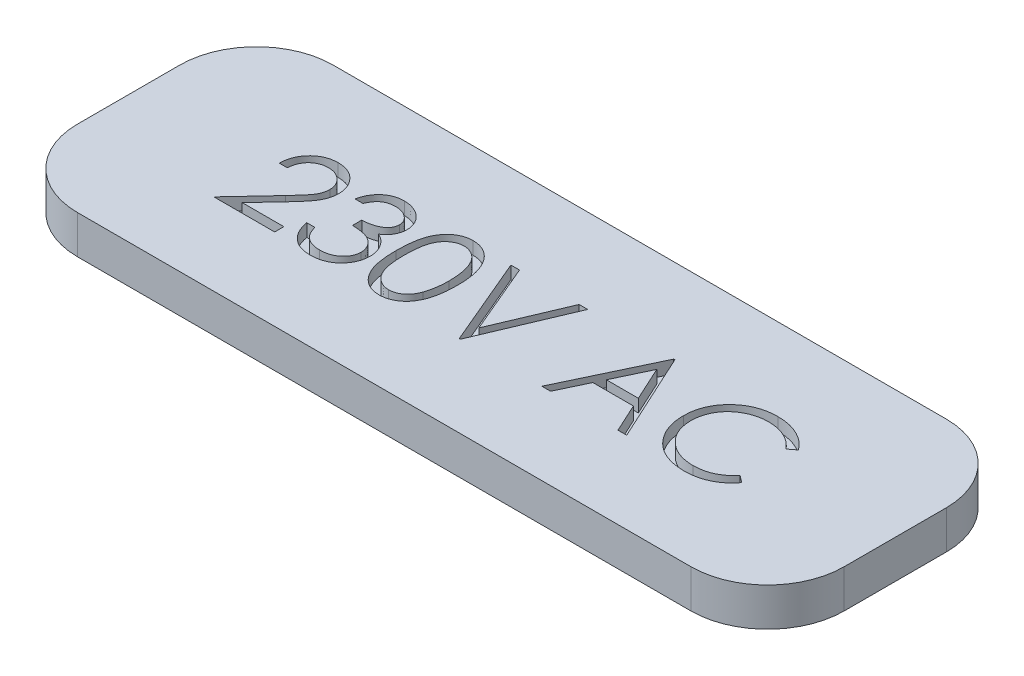
from build123d import *

# Parameters (mm, degrees)
SKETCH1_W           = 30
SKETCH1_H           = 10
BOSS_EXTRUDE1_DEPTH = 1.5
FILLET1_R           = 3
CUT_EXTRUDE1_DEPTH  = 0.5


with BuildPart() as part:
    # Sketch1 → Boss-Extrude1 (new body)
    with BuildSketch(Plane(origin=(0, 0, 0), x_dir=(1, 0, 0), z_dir=(0, 1, 0))):
        with Locations((-15, -5)):
            Rectangle(SKETCH1_W, SKETCH1_H)
    extrude(amount=BOSS_EXTRUDE1_DEPTH)

    # Fillet1
    fillet1_edges = [part.edges().sort_by_distance(p)[0] for p in [
        (0, 0.75, 10),
        (-30, 0.75, 10),
        (-30, 0.75, 0),
        (0, 0.75, 0),
    ]]
    fillet(fillet1_edges, radius=FILLET1_R)

    # Sketch2 → Cut-Extrude1 (cut)
    # profile 1 of 6: a face of its own
    with BuildSketch(Plane(origin=(0, 1.5, 0), x_dir=(1, 0, 0), z_dir=(0, 1, 0))):
        with BuildLine():
            Line((-24.416666667, -4.376923077), (-24.730769231, -4.376923077))
            add(Edge.make_bspline(
                [(-24.730769231, -4.376923077), (-24.728722078, -4.335252189), (-24.724701524, -4.253411675), (-24.705873234, -4.134087768), (-24.678932357, -4.020032969), (-24.640840903, -3.912163055), (-24.593534625, -3.809524248), (-24.536804598, -3.712524233), (-24.469610748, -3.621533044), (-24.393404014, -3.537394201), (-24.310635374, -3.46020663), (-24.221329435, -3.393551387), (-24.127484408, -3.337233716), (-24.029385009, -3.290152474), (-23.925924445, -3.254812628), (-23.818041587, -3.228590988), (-23.705262451, -3.212814643), (-23.628422429, -3.211118857), (-23.589342949, -3.21025641)],
                knots=[0, 0, 0, 0, 1.10065271, 2.161652631, 3.183658789, 4.190468796, 5.17591951, 6.163126047, 7.15150782, 8.156236427, 9.156009102, 10.134482811, 11.092018607, 12.041330605, 13.001268258, 13.972401359, 14.968799086, 16, 16, 16, 16], degree=3))
            add(Edge.make_bspline(
                [(-23.589342949, -3.21025641), (-23.550964875, -3.211154867), (-23.47555333, -3.212920302), (-23.365491316, -3.228081331), (-23.260714021, -3.251826922), (-23.161426255, -3.285142339), (-23.06842019, -3.329926766), (-22.980997145, -3.383724305), (-22.898116335, -3.445944136), (-22.823509551, -3.51919795), (-22.755001472, -3.597400334), (-22.695899217, -3.680888238), (-22.645286053, -3.767117523), (-22.603098373, -3.856745725), (-22.572042234, -3.950616753), (-22.548464026, -4.047363956), (-22.535136613, -4.147988767), (-22.533091189, -4.216095323), (-22.532051282, -4.250721154)],
                knots=[0, 0, 0, 0, 1.111607364, 2.184268762, 3.212621178, 4.221274766, 5.211760367, 6.196651075, 7.1921475, 8.207485113, 9.220403448, 10.201281604, 11.166441695, 12.114753415, 13.065576456, 14.026450734, 14.996634279, 16, 16, 16, 16], degree=3))
            add(Edge.make_bspline(
                [(-22.532051282, -4.250721154), (-22.533744545, -4.299468988), (-22.537101356, -4.396109202), (-22.565815733, -4.538124065), (-22.610662244, -4.675717484), (-22.664659601, -4.786454786), (-22.719132045, -4.87568828), (-22.768219552, -4.949156985), (-22.825684363, -5.028262453), (-22.892362861, -5.11273979), (-22.966875734, -5.203250696), (-23.049897897, -5.299740491), (-23.142021379, -5.401212261), (-23.20667988, -5.470517862), (-23.240184295, -5.506430288)],
                knots=[0, 0, 0, 0, 1.184426356, 2.348067706, 3.509069118, 4.696110526, 5.333549288, 6.050745305, 6.844228056, 7.710549037, 8.667450064, 9.695053472, 10.805634456, 12, 12, 12, 12], degree=3))
            Line((-23.240184295, -5.506430288), (-24.115885417, -6.441025641))
            Line((-24.115885417, -6.441025641), (-22.487179487, -6.441025641))
            Line((-22.487179487, -6.441025641), (-22.487179487, -6.8))
            Line((-22.487179487, -6.8), (-24.865384615, -6.8))
            Line((-24.865384615, -6.8), (-23.508012821, -5.351482372))
            add(Edge.make_bspline(
                [(-23.508012821, -5.351482372), (-23.474964934, -5.316984065), (-23.411486707, -5.250719879), (-23.32170413, -5.153976919), (-23.241065141, -5.064227378), (-23.169047749, -4.981640829), (-23.107214243, -4.905009262), (-23.052342011, -4.836814558), (-23.00837642, -4.774060108), (-22.960661025, -4.701319494), (-22.914447043, -4.612507177), (-22.874734687, -4.503973487), (-22.850519839, -4.392246235), (-22.847615003, -4.316744198), (-22.846153846, -4.278766026)],
                knots=[0, 0, 0, 0, 1.329631726, 2.553950428, 3.673215718, 4.687767853, 5.603093632, 6.413772471, 7.123043292, 7.734684054, 8.834405432, 9.900288307, 10.943827018, 12, 12, 12, 12], degree=3))
            add(Edge.make_bspline(
                [(-22.846153846, -4.278766026), (-22.846789588, -4.254884627), (-22.848042514, -4.207818977), (-22.859100212, -4.138813218), (-22.875810718, -4.072248404), (-22.899755976, -4.007919785), (-22.931362716, -3.946474133), (-22.969836096, -3.887836653), (-23.01422616, -3.831147687), (-23.065577429, -3.777994389), (-23.121988949, -3.729313184), (-23.181583198, -3.686189098), (-23.244633302, -3.650149988), (-23.310873425, -3.620606491), (-23.380118894, -3.597431109), (-23.452503639, -3.58137253), (-23.527827655, -3.571290046), (-23.579261151, -3.569925874), (-23.60546875, -3.569230769)],
                knots=[0, 0, 0, 0, 0.991446411, 1.95395049, 2.89581595, 3.838931463, 4.798493298, 5.75982156, 6.748411868, 7.785213223, 8.824556874, 9.840280684, 10.836137867, 11.835679398, 12.848801643, 13.863922112, 14.911575587, 16, 16, 16, 16], degree=3))
            add(Edge.make_bspline(
                [(-23.60546875, -3.569230769), (-23.632839583, -3.569945801), (-23.686591379, -3.571350007), (-23.765510412, -3.581172671), (-23.840796189, -3.598118511), (-23.912638092, -3.621295186), (-23.981157678, -3.650753734), (-24.046021722, -3.687445479), (-24.107084611, -3.731228972), (-24.164461135, -3.780869529), (-24.217325114, -3.83613713), (-24.26377199, -3.897747093), (-24.304356004, -3.964574508), (-24.339765237, -4.036439059), (-24.368520927, -4.113992839), (-24.390494078, -4.196960544), (-24.407880925, -4.284981925), (-24.413689445, -4.34576701), (-24.416666667, -4.376923077)],
                knots=[0, 0, 0, 0, 1.031018746, 2.02475058, 2.990194455, 3.934040569, 4.864654155, 5.795059489, 6.735614925, 7.690564532, 8.649604399, 9.611025574, 10.590972636, 11.591080095, 12.624614302, 13.701020113, 14.821632451, 16, 16, 16, 16], degree=3))
        make_face()
    # profile 2 of 6: a face of its own
    with BuildSketch(Plane(origin=(0, 1.5, 0), x_dir=(1, 0, 0), z_dir=(0, 1, 0))):
        with BuildLine():
            Line((-21.724358974, -4.107692308), (-22.038461538, -4.107692308))
            add(Edge.make_bspline(
                [(-22.038461538, -4.107692308), (-22.029951988, -4.072459824), (-22.013316512, -4.003583199), (-21.978618939, -3.905175938), (-21.940819684, -3.812052417), (-21.895430579, -3.725956343), (-21.845921825, -3.645157441), (-21.789199103, -3.571488316), (-21.727879381, -3.503075351), (-21.660054431, -3.442362113), (-21.58892577, -3.387384384), (-21.51349115, -3.340509327), (-21.435268256, -3.300185174), (-21.353715123, -3.266964942), (-21.268588952, -3.241939418), (-21.180659328, -3.223782613), (-21.089695828, -3.211991498), (-21.027948238, -3.210840735), (-20.996594551, -3.21025641)],
                knots=[0, 0, 0, 0, 1.162005537, 2.271625781, 3.343758855, 4.383309926, 5.390229558, 6.379919256, 7.361854164, 8.333198761, 9.295911338, 10.242430842, 11.177959212, 12.116337295, 13.062827104, 14.020064771, 14.994644689, 16, 16, 16, 16], degree=3))
            add(Edge.make_bspline(
                [(-20.996594551, -3.21025641), (-20.950911809, -3.211635641), (-20.860542798, -3.214364016), (-20.727779751, -3.239278452), (-20.599752932, -3.278703585), (-20.477863684, -3.333177312), (-20.364645252, -3.400364625), (-20.263909065, -3.480329362), (-20.177020554, -3.571528663), (-20.104126177, -3.672261228), (-20.047051178, -3.779916737), (-20.004964804, -3.890716894), (-19.979343123, -4.004398866), (-19.976022566, -4.081156145), (-19.974358974, -4.119611378)],
                knots=[0, 0, 0, 0, 1.083050992, 2.142477498, 3.193116406, 4.255571735, 5.30263384, 6.308962982, 7.297363603, 8.282367274, 9.249857812, 10.179914175, 11.08814088, 12, 12, 12, 12], degree=3))
            add(Edge.make_bspline(
                [(-19.974358974, -4.119611378), (-19.975522565, -4.156618173), (-19.977799533, -4.229034727), (-19.997133238, -4.334756225), (-20.029669501, -4.434397825), (-20.074739264, -4.528378987), (-20.133080814, -4.616103827), (-20.203753511, -4.697769718), (-20.287256172, -4.773738876), (-20.35053511, -4.817258349), (-20.383112981, -4.839663462)],
                knots=[0, 0, 0, 0, 1.024540389, 2.004866551, 2.965041327, 3.920577974, 4.882998113, 5.874504559, 6.905732034, 8, 8, 8, 8], degree=3))
            add(Edge.make_bspline(
                [(-20.383112981, -4.839663462), (-20.345881226, -4.857641633), (-20.272114352, -4.893261591), (-20.171563822, -4.963117348), (-20.080285947, -5.043773696), (-20.029382228, -5.106716348), (-20.00380609, -5.138341346)],
                knots=[0, 0, 0, 0, 1.015518401, 2.012035669, 3.001164323, 4, 4, 4, 4], degree=3))
            add(Edge.make_bspline(
                [(-20.00380609, -5.138341346), (-19.986964747, -5.161399098), (-19.953557851, -5.207137014), (-19.912322318, -5.28067344), (-19.874913203, -5.355024929), (-19.845762984, -5.432184336), (-19.823189117, -5.511257349), (-19.807053085, -5.592379745), (-19.797028944, -5.675617768), (-19.795593392, -5.731930248), (-19.794871795, -5.760236378)],
                knots=[0, 0, 0, 0, 1.025084078, 2.033381695, 3.024893161, 4.013698104, 4.991890475, 5.976764909, 6.982997093, 8, 8, 8, 8], degree=3))
            add(Edge.make_bspline(
                [(-19.794871795, -5.760236378), (-19.796666308, -5.809246099), (-19.80024689, -5.907034901), (-19.832250965, -6.051509623), (-19.881864205, -6.192735125), (-19.952321141, -6.327809964), (-20.03818865, -6.454190345), (-20.140345974, -6.567266654), (-20.257632383, -6.664465259), (-20.388438032, -6.745675487), (-20.53015516, -6.810593409), (-20.681730752, -6.855650852), (-20.840980806, -6.884996852), (-20.950188104, -6.88814372), (-21.005709135, -6.88974359)],
                knots=[0, 0, 0, 0, 0.955779014, 1.907060117, 2.875433937, 3.871313158, 4.872415639, 5.851225146, 6.836215519, 7.83643374, 8.849228613, 9.86973379, 10.916971861, 12, 12, 12, 12], degree=3))
            add(Edge.make_bspline(
                [(-21.005709135, -6.88974359), (-21.043128435, -6.888875376), (-21.11675714, -6.887167022), (-21.225000638, -6.875488421), (-21.328322338, -6.854158416), (-21.426861936, -6.825455111), (-21.520706972, -6.789063368), (-21.609571077, -6.74374467), (-21.694000971, -6.690433168), (-21.773199922, -6.628499581), (-21.84715849, -6.559218241), (-21.913911214, -6.481359231), (-21.974571007, -6.396361827), (-22.027513645, -6.303238771), (-22.075150598, -6.203193513), (-22.114331555, -6.094945015), (-22.148817123, -5.979460993), (-22.164850588, -5.898983253), (-22.173076923, -5.857692308)],
                knots=[0, 0, 0, 0, 1.048658725, 2.063410685, 3.046034179, 4.001477787, 4.936774919, 5.862367409, 6.792675028, 7.730719943, 8.675894397, 9.627829632, 10.600096036, 11.597688215, 12.626045268, 13.701542398, 14.82072376, 16, 16, 16, 16], degree=3))
            Line((-22.173076923, -5.857692308), (-21.858974359, -5.857692308))
            add(Edge.make_bspline(
                [(-21.858974359, -5.857692308), (-21.850791068, -5.884641321), (-21.834873855, -5.937059493), (-21.807779557, -6.012499798), (-21.776911285, -6.081657851), (-21.743796726, -6.145040973), (-21.70901828, -6.203273376), (-21.670103355, -6.254815245), (-21.62993421, -6.301930447), (-21.599654856, -6.328475059), (-21.584835737, -6.341466346)],
                knots=[0, 0, 0, 0, 1.198163088, 2.33053128, 3.407730985, 4.417276592, 5.372219308, 6.28897303, 7.162600585, 8, 8, 8, 8], degree=3))
            add(Edge.make_bspline(
                [(-21.584835737, -6.341466346), (-21.565239161, -6.35657468), (-21.526106498, -6.386744712), (-21.462338267, -6.42524634), (-21.395273381, -6.458607366), (-21.323458706, -6.484091061), (-21.248443936, -6.505668722), (-21.169016571, -6.519789241), (-21.085877354, -6.529477413), (-21.02910959, -6.530332344), (-21.00010016, -6.530769231)],
                knots=[0, 0, 0, 0, 0.946170439, 1.889420265, 2.845303464, 3.807233317, 4.801018734, 5.828864929, 6.890507805, 8, 8, 8, 8], degree=3))
            add(Edge.make_bspline(
                [(-21.00010016, -6.530769231), (-20.967346658, -6.530153326), (-20.903300011, -6.528948976), (-20.809845151, -6.517873269), (-20.720937704, -6.501742856), (-20.637564778, -6.476829873), (-20.558634271, -6.446049021), (-20.485252621, -6.407400616), (-20.416456515, -6.362055894), (-20.353127109, -6.310516736), (-20.296181602, -6.254095241), (-20.246042089, -6.19508217), (-20.203417427, -6.13372634), (-20.169033849, -6.069688219), (-20.141883299, -6.00323299), (-20.123400098, -5.934174161), (-20.110548583, -5.863076895), (-20.109501971, -5.814747926), (-20.108974359, -5.790384615)],
                knots=[0, 0, 0, 0, 1.217147791, 2.380027433, 3.494444702, 4.572153297, 5.609568379, 6.639424714, 7.649109417, 8.668170816, 9.669597737, 10.625200337, 11.543417969, 12.441394052, 13.322311151, 14.205496177, 15.095365482, 16, 16, 16, 16], degree=3))
            add(Edge.make_bspline(
                [(-20.108974359, -5.790384615), (-20.110504661, -5.757773277), (-20.113557649, -5.692712868), (-20.136866228, -5.596995294), (-20.175205093, -5.504771882), (-20.228877604, -5.417616091), (-20.294213333, -5.33684019), (-20.370578239, -5.264768707), (-20.458606468, -5.205298616), (-20.539626337, -5.16420996), (-20.611391493, -5.136172885), (-20.672806878, -5.11749792), (-20.741563481, -5.101684265), (-20.81682983, -5.086971993), (-20.899173046, -5.074450645), (-20.988503484, -5.064008829), (-21.084839246, -5.055653788), (-21.151530412, -5.051922693), (-21.185897436, -5.05)],
                knots=[0, 0, 0, 0, 1.07054697, 2.135767047, 3.216561865, 4.33974944, 5.486079747, 6.621378074, 7.775625952, 8.963672916, 9.598146892, 10.304877434, 11.070270905, 11.915000392, 12.823868403, 13.805723172, 14.86925407, 16, 16, 16, 16], degree=3))
            Line((-21.185897436, -5.05), (-21.185897436, -4.691025641))
            add(Edge.make_bspline(
                [(-21.185897436, -4.691025641), (-21.14259627, -4.690290837), (-21.057779924, -4.688851537), (-20.933885619, -4.671443527), (-20.815412307, -4.647362899), (-20.704985565, -4.610477707), (-20.604336851, -4.56763741), (-20.517017249, -4.5177852), (-20.444250102, -4.462370451), (-20.386389031, -4.400537842), (-20.342859802, -4.334222794), (-20.311033004, -4.265106136), (-20.292232678, -4.192582076), (-20.289723011, -4.143087408), (-20.288461538, -4.118209135)],
                knots=[0, 0, 0, 0, 1.321986639, 2.589447074, 3.816329219, 5.01088745, 6.139805852, 7.153945165, 8.075214402, 8.924034688, 9.728124013, 10.488707548, 11.240355623, 12, 12, 12, 12], degree=3))
            add(Edge.make_bspline(
                [(-20.288461538, -4.118209135), (-20.288875949, -4.099931389), (-20.2897004, -4.063568682), (-20.300097678, -4.010443614), (-20.315721719, -3.958942668), (-20.337201448, -3.909284858), (-20.365951647, -3.861814584), (-20.400357634, -3.816127135), (-20.441325734, -3.772483356), (-20.488271181, -3.731803036), (-20.538682986, -3.693033799), (-20.593932761, -3.660120162), (-20.652354636, -3.6319751), (-20.714013291, -3.608765598), (-20.779108821, -3.59130631), (-20.847335379, -3.578770468), (-20.918823062, -3.570932813), (-20.967594794, -3.569804398), (-20.992387821, -3.569230769)],
                knots=[0, 0, 0, 0, 0.884392785, 1.759457502, 2.611959086, 3.489218968, 4.37281399, 5.2945488, 6.255912374, 7.266815255, 8.301784654, 9.332968512, 10.37626691, 11.440494194, 12.520033166, 13.637162961, 14.798855837, 16, 16, 16, 16], degree=3))
            add(Edge.make_bspline(
                [(-20.992387821, -3.569230769), (-21.032239489, -3.570622131), (-21.110079065, -3.573339785), (-21.222293982, -3.597142798), (-21.326613316, -3.635120882), (-21.406351982, -3.680453901), (-21.465234557, -3.725204335), (-21.507311495, -3.764286721), (-21.548632005, -3.807719545), (-21.586477682, -3.85817792), (-21.624751659, -3.912244711), (-21.65959622, -3.972668392), (-21.693455912, -4.037872786), (-21.713858462, -4.083968421), (-21.724358974, -4.107692308)],
                knots=[0, 0, 0, 0, 1.472543308, 2.876219568, 4.221790263, 5.565193594, 6.249813518, 6.953379497, 7.687249741, 8.463570142, 9.283606569, 10.136032583, 11.040678096, 12, 12, 12, 12], degree=3))
        make_face()
    # profile 3 of 6: a face of its own
    with BuildSketch(Plane(origin=(0, 1.5, 0), x_dir=(1, 0, 0), z_dir=(0, 1, 0))):
        with BuildLine():
            add(Edge.make_bspline(
                [(-19.480769231, -5.051402244), (-19.480441213, -4.995304856), (-19.479804033, -4.886334872), (-19.472715612, -4.72755023), (-19.460940269, -4.578589941), (-19.444802897, -4.439446875), (-19.425164916, -4.31008511), (-19.39894943, -4.190850353), (-19.369136627, -4.081190746), (-19.334584181, -3.980748698), (-19.295596392, -3.888170995), (-19.253162132, -3.801745793), (-19.205597337, -3.721603861), (-19.155620424, -3.646466071), (-19.101208353, -3.577562376), (-19.043909562, -3.513919713), (-18.981487686, -3.457008963), (-18.916064678, -3.405162661), (-18.847048213, -3.359713189), (-18.776405547, -3.31968045), (-18.703650441, -3.285480583), (-18.628584258, -3.258590147), (-18.5518817, -3.2363793), (-18.473274634, -3.221190353), (-18.39263327, -3.211633444), (-18.338201835, -3.210719776), (-18.310596955, -3.21025641)],
                knots=[0, 0, 0, 0, 1.646270934, 3.197905019, 4.663502075, 6.030701355, 7.308322542, 8.50163776, 9.611534131, 10.641858119, 11.616356847, 12.558055219, 13.465016945, 14.349605745, 15.204443733, 16.039544428, 16.859896111, 17.680448484, 18.487036065, 19.28249412, 20.06191084, 20.843045899, 21.620316918, 22.403196591, 23.190181807, 24, 24, 24, 24], degree=3))
            add(Edge.make_bspline(
                [(-18.310596955, -3.21025641), (-18.282761477, -3.210744225), (-18.227405468, -3.211714336), (-18.145565093, -3.221038279), (-18.065615411, -3.236509402), (-17.987897272, -3.258430377), (-17.911772286, -3.285626053), (-17.837835878, -3.31971317), (-17.765628796, -3.359392038), (-17.696298509, -3.406015915), (-17.629083893, -3.457998191), (-17.56563593, -3.51676086), (-17.505948845, -3.581710579), (-17.449273539, -3.652152443), (-17.397217942, -3.729437528), (-17.34764451, -3.812221638), (-17.303272474, -3.901952503), (-17.260537799, -3.99713297), (-17.223650812, -4.100396629), (-17.190384567, -4.21116139), (-17.163505598, -4.330735577), (-17.141116326, -4.458491822), (-17.12377143, -4.594899305), (-17.111138788, -4.739665621), (-17.104465703, -4.892886011), (-17.103209001, -4.99764386), (-17.102564103, -5.051402244)],
                knots=[0, 0, 0, 0, 0.810914788, 1.612654377, 2.396697861, 3.181598691, 3.963628158, 4.749916497, 5.551656086, 6.361998678, 7.18212741, 8.025565596, 8.878627764, 9.750805457, 10.657531673, 11.591944965, 12.560506719, 13.57287815, 14.630710178, 15.753379473, 16.941251878, 18.199788006, 19.531962791, 20.947069417, 22.433333509, 24, 24, 24, 24], degree=3))
            add(Edge.make_bspline(
                [(-17.102564103, -5.051402244), (-17.103215687, -5.104926152), (-17.104485273, -5.209215303), (-17.11106398, -5.361746279), (-17.124022611, -5.505744322), (-17.140232599, -5.641554784), (-17.162683562, -5.768612403), (-17.190288728, -5.887356852), (-17.220939051, -5.998300923), (-17.258773845, -6.100535735), (-17.300184556, -6.195487458), (-17.345239752, -6.284154606), (-17.393509578, -6.367320899), (-17.446098323, -6.444320646), (-17.502151736, -6.515699303), (-17.562869525, -6.580196926), (-17.62654011, -6.639367598), (-17.693952526, -6.692019225), (-17.764364077, -6.73810403), (-17.836323154, -6.77931788), (-17.911106537, -6.812550575), (-17.98701949, -6.841085616), (-18.065147856, -6.862886068), (-18.145394247, -6.877959923), (-18.227350483, -6.888531772), (-18.282752048, -6.889338252), (-18.310596955, -6.88974359)],
                knots=[0, 0, 0, 0, 1.561518951, 3.042555995, 4.452378317, 5.7783523, 7.031515105, 8.214008947, 9.334062868, 10.386615937, 11.391082383, 12.354592575, 13.286541444, 14.194233754, 15.072674879, 15.931287219, 16.775624067, 17.606195743, 18.42308326, 19.229000347, 20.022332153, 20.807536673, 21.593273796, 22.3848459, 23.188221202, 24, 24, 24, 24], degree=3))
            add(Edge.make_bspline(
                [(-18.310596955, -6.88974359), (-18.338201069, -6.889277234), (-18.392630994, -6.888357672), (-18.473283419, -6.878843941), (-18.551565863, -6.863548438), (-18.627864617, -6.842131834), (-18.702571132, -6.815916997), (-18.774667419, -6.781763314), (-18.844955102, -6.742429245), (-18.913246658, -6.697633823), (-18.978258819, -6.64631214), (-19.040357425, -6.589547851), (-19.097982444, -6.52592444), (-19.151616539, -6.456446517), (-19.202590628, -6.381753275), (-19.249480001, -6.300824902), (-19.292850855, -6.213982291), (-19.332494346, -6.12066438), (-19.367643009, -6.019509453), (-19.398690717, -5.909360274), (-19.423204875, -5.789244638), (-19.44418783, -5.660127271), (-19.461112213, -5.521453341), (-19.472666538, -5.373147562), (-19.479807853, -5.215302353), (-19.480442924, -5.107032579), (-19.480769231, -5.051402244)],
                knots=[0, 0, 0, 0, 0.810891512, 1.598919785, 2.382837074, 3.152667961, 3.926044502, 4.706494248, 5.493654104, 6.291793342, 7.103789334, 7.925228297, 8.761435821, 9.622817696, 10.50288917, 11.416980706, 12.369136599, 13.353924996, 14.394355917, 15.514179734, 16.714354668, 17.994756427, 19.357759367, 20.818452758, 22.365282078, 24, 24, 24, 24], degree=3))
        make_face()
        with BuildLine():
            add(Edge.make_bspline(
                [(-19.166666667, -5.05), (-19.16654722, -5.096748699), (-19.166315396, -5.187478744), (-19.160259196, -5.319322005), (-19.152008964, -5.442292333), (-19.141367667, -5.55654587), (-19.125564718, -5.661695882), (-19.10785793, -5.758465565), (-19.086309841, -5.846342803), (-19.060814823, -5.925930613), (-19.031775726, -5.998579682), (-19.000069862, -6.066180897), (-18.966009139, -6.129532833), (-18.927889989, -6.188066442), (-18.886374925, -6.241972606), (-18.842401666, -6.292205438), (-18.794329082, -6.337002419), (-18.72782534, -6.390729274), (-18.640028865, -6.446248408), (-18.52940841, -6.494594498), (-18.415739959, -6.524976954), (-18.338588709, -6.52884071), (-18.300080128, -6.530769231)],
                knots=[0, 0, 0, 0, 1.459021318, 2.831673884, 4.118529203, 5.306027144, 6.411944654, 7.436330062, 8.375795394, 9.233974572, 10.042671642, 10.816086306, 11.563610507, 12.285937304, 12.993564865, 13.685989202, 14.367179055, 15.041617293, 16.353048772, 17.594441528, 18.799311195, 20, 20, 20, 20], degree=3))
            add(Edge.make_bspline(
                [(-18.300080128, -6.530769231), (-18.261322457, -6.52917145), (-18.183887133, -6.525979187), (-18.070753338, -6.49518045), (-17.960923068, -6.44871091), (-17.874851128, -6.393763405), (-17.809368584, -6.341435075), (-17.762451594, -6.296820427), (-17.719389546, -6.24686456), (-17.678547471, -6.192965264), (-17.641088395, -6.13409278), (-17.607025258, -6.070530204), (-17.57594191, -6.002101027), (-17.558232864, -5.954331287), (-17.549178686, -5.929907853)],
                knots=[0, 0, 0, 0, 1.353760809, 2.704726607, 4.075137775, 5.516104923, 6.260822281, 7.007110065, 7.778089737, 8.566572457, 9.372053459, 10.217411131, 11.088608312, 12, 12, 12, 12], degree=3))
            add(Edge.make_bspline(
                [(-17.549178686, -5.929907853), (-17.538626918, -5.898678113), (-17.517202304, -5.835268349), (-17.48959053, -5.736904697), (-17.467845131, -5.633701933), (-17.448281765, -5.526276816), (-17.434928709, -5.413837115), (-17.424180896, -5.296730731), (-17.417850209, -5.174869369), (-17.417065458, -5.092074378), (-17.416666667, -5.05)],
                knots=[0, 0, 0, 0, 0.884706709, 1.796334032, 2.740027952, 3.714592787, 4.726048262, 5.777819803, 6.87074269, 8, 8, 8, 8], degree=3))
            add(Edge.make_bspline(
                [(-17.416666667, -5.05), (-17.417216856, -5.007932427), (-17.418293144, -4.925639263), (-17.422407131, -4.805121082), (-17.433030706, -4.690653321), (-17.444829825, -4.581742848), (-17.462227046, -4.478992546), (-17.480984853, -4.381542241), (-17.506186065, -4.290599216), (-17.53310584, -4.204739634), (-17.563916235, -4.124938979), (-17.59783197, -4.050825193), (-17.634053729, -3.982040468), (-17.673395969, -3.918773527), (-17.715391652, -3.860740984), (-17.761149201, -3.809106389), (-17.808853574, -3.762269421), (-17.87567076, -3.708806852), (-17.96314505, -3.654295157), (-18.071990697, -3.604129397), (-18.185261341, -3.575321104), (-18.261834795, -3.571259417), (-18.300080128, -3.569230769)],
                knots=[0, 0, 0, 0, 1.31362396, 2.569729283, 3.763502607, 4.902122613, 5.988968491, 7.01645872, 7.998833611, 8.933434873, 9.825090667, 10.667526885, 11.477055099, 12.250526234, 12.991942729, 13.710640831, 14.402115721, 15.076753259, 16.378508321, 17.609869233, 18.806226677, 20, 20, 20, 20], degree=3))
            add(Edge.make_bspline(
                [(-18.300080128, -3.569230769), (-18.33879072, -3.571262216), (-18.416282426, -3.57532881), (-18.530730381, -3.604022064), (-18.640434732, -3.65403503), (-18.727677707, -3.708987402), (-18.794541493, -3.761325713), (-18.841624187, -3.806712167), (-18.885770359, -3.856358422), (-18.926438059, -3.910760337), (-18.964527342, -3.969225704), (-18.999508355, -4.032214469), (-19.031025685, -4.100045833), (-19.060110221, -4.172662268), (-19.085683009, -4.252243213), (-19.106776972, -4.340012206), (-19.126264025, -4.436474098), (-19.140059294, -4.542193606), (-19.15232305, -4.65647576), (-19.160204398, -4.779753078), (-19.166335655, -4.911817458), (-19.16655412, -5.003016617), (-19.166666667, -5.05)],
                knots=[0, 0, 0, 0, 1.207732386, 2.417664972, 3.655092373, 4.956220595, 5.625982001, 6.301752483, 6.994047911, 7.697131622, 8.419323945, 9.170223765, 9.943494443, 10.752040957, 11.610060368, 12.549350801, 13.567764191, 14.679664412, 15.874934091, 17.154273443, 18.533957287, 20, 20, 20, 20], degree=3))
        make_face(mode=Mode.SUBTRACT)
    # profile 4 of 6: a face of its own
    with BuildSketch(Plane(origin=(0, 1.5, 0), x_dir=(1, 0, 0), z_dir=(0, 1, 0))):
        Polygon((-16.743589744, -3.3), (-16.407051282, -3.3), (-15.240384615, -6.058213141), (-14.073717949, -3.3), (-13.737179487, -3.3), (-15.217948718, -6.8), (-15.262820513, -6.8), align=None)
    # profile 5 of 6: a face of its own
    with BuildSketch(Plane(origin=(0, 1.5, 0), x_dir=(1, 0, 0), z_dir=(0, 1, 0))):
        Polygon((-10.326923077, -3.3), (-8.711538462, -6.8), (-9.052984776, -6.8), (-9.57041266, -5.678205128), (-11.157051282, -5.678205128), (-11.689202724, -6.8), (-12.032051282, -6.8), (-10.371794872, -3.3), align=None)
        Polygon((-10.352864583, -3.982191506), (-10.986678686, -5.319230769), (-9.735877404, -5.319230769), align=None, mode=Mode.SUBTRACT)
    # profile 6 of 6: a face of its own
    with BuildSketch(Plane(origin=(0, 1.5, 0), x_dir=(1, 0, 0), z_dir=(0, 1, 0))):
        with BuildLine():
            Line((-4.852564103, -3.942227564), (-5.127403846, -4.152564103))
            add(Edge.make_bspline(
                [(-5.127403846, -4.152564103), (-5.147009735, -4.129198133), (-5.185957181, -4.082781217), (-5.248616384, -4.017601673), (-5.313918027, -3.956536411), (-5.381837148, -3.899294531), (-5.453596267, -3.847877766), (-5.527457066, -3.799606663), (-5.604655111, -3.756338925), (-5.711406846, -3.703875939), (-5.851054694, -3.649129784), (-6.026849533, -3.603226552), (-6.210360632, -3.574005377), (-6.335558231, -3.570840535), (-6.399238782, -3.569230769)],
                knots=[0, 0, 0, 0, 0.757959112, 1.505699292, 2.245454638, 2.979532153, 3.711538275, 4.438200793, 5.171680507, 5.909471876, 7.393775596, 8.890124382, 10.418191784, 12, 12, 12, 12], degree=3))
            add(Edge.make_bspline(
                [(-6.399238782, -3.569230769), (-6.434322081, -3.569634732), (-6.504163074, -3.570438908), (-6.607811547, -3.581048033), (-6.709524599, -3.595959243), (-6.809236065, -3.618084566), (-6.906819023, -3.646057185), (-7.002911425, -3.679482599), (-7.096122025, -3.720837439), (-7.187740263, -3.766545699), (-7.275519474, -3.818173144), (-7.358574522, -3.874486496), (-7.43660249, -3.934855592), (-7.509665102, -3.999506698), (-7.577837051, -4.068148659), (-7.640624361, -4.141513), (-7.697809772, -4.219365174), (-7.750526797, -4.300678581), (-7.79773953, -4.385216373), (-7.837269409, -4.473291444), (-7.872274532, -4.563395547), (-7.899973774, -4.656546707), (-7.921898291, -4.752089473), (-7.937025954, -4.850280261), (-7.947514426, -4.950913941), (-7.948314603, -5.019123253), (-7.948717949, -5.053505609)],
                knots=[0, 0, 0, 0, 1.054917814, 2.100044995, 3.131103042, 4.146048494, 5.169673617, 6.183595914, 7.203665975, 8.234915748, 9.262203917, 10.264457458, 11.251630812, 12.227803204, 13.197192746, 14.159520551, 15.12972552, 16.100847026, 17.073214652, 18.039054194, 19.002613845, 19.979014051, 20.95965708, 21.949030935, 22.966165397, 24, 24, 24, 24], degree=3))
            add(Edge.make_bspline(
                [(-7.948717949, -5.053505609), (-7.94745613, -5.105236929), (-7.944978715, -5.206804514), (-7.922930381, -5.355575124), (-7.88942529, -5.498095798), (-7.839209713, -5.63347564), (-7.777290663, -5.763383998), (-7.699050051, -5.885622852), (-7.608433514, -6.002039416), (-7.504159094, -6.109882364), (-7.389753278, -6.208396089), (-7.267005367, -6.295146671), (-7.136221079, -6.367461553), (-6.998844449, -6.4276375), (-6.853818335, -6.473894228), (-6.701403532, -6.506458351), (-6.541931537, -6.527700532), (-6.432962137, -6.52973422), (-6.377504006, -6.530769231)],
                knots=[0, 0, 0, 0, 1.029171465, 2.020641659, 2.987623507, 3.938342917, 4.889210282, 5.84687017, 6.821220943, 7.821438502, 8.827599549, 9.822697543, 10.807740252, 11.797342354, 12.80366471, 13.83203677, 14.896651826, 16, 16, 16, 16], degree=3))
            add(Edge.make_bspline(
                [(-6.377504006, -6.530769231), (-6.316401317, -6.529080451), (-6.196136608, -6.525756528), (-6.019768582, -6.497597279), (-5.850932817, -6.451939362), (-5.68962023, -6.388041439), (-5.536285584, -6.304976151), (-5.390688923, -6.204278274), (-5.252707353, -6.084989941), (-5.169736071, -5.993906813), (-5.127403846, -5.947435897)],
                knots=[0, 0, 0, 0, 1.028121516, 2.023589091, 2.998037872, 3.967518031, 4.937445131, 5.927275754, 6.942489185, 8, 8, 8, 8], degree=3))
            Line((-5.127403846, -5.947435897), (-4.852564103, -6.155669071))
            add(Edge.make_bspline(
                [(-4.852564103, -6.155669071), (-4.874682212, -6.184207522), (-4.918812488, -6.241147729), (-4.990270505, -6.321419438), (-5.065547802, -6.396923474), (-5.145203512, -6.467051095), (-5.228321304, -6.533205561), (-5.316393616, -6.593507392), (-5.408262649, -6.648798276), (-5.503617127, -6.699425201), (-5.60235574, -6.744342448), (-5.704360175, -6.782796216), (-5.809190751, -6.815921105), (-5.916852259, -6.843173042), (-6.027568016, -6.864444126), (-6.14093849, -6.878663801), (-6.257208365, -6.888405715), (-6.335649786, -6.889293631), (-6.375400641, -6.88974359)],
                knots=[0, 0, 0, 0, 0.986787822, 1.968848986, 2.935600012, 3.899624008, 4.868462664, 5.837806735, 6.815139263, 7.798259679, 8.787526145, 9.778297419, 10.776456485, 11.791383307, 12.812564526, 13.85620153, 14.913611965, 16, 16, 16, 16], degree=3))
            add(Edge.make_bspline(
                [(-6.375400641, -6.88974359), (-6.413044308, -6.889481597), (-6.487479998, -6.888963539), (-6.59737875, -6.880571372), (-6.704368331, -6.869121635), (-6.808142956, -6.851881504), (-6.909268932, -6.831537164), (-7.006829516, -6.804265907), (-7.101784726, -6.773716741), (-7.193753067, -6.737811754), (-7.282812767, -6.697295571), (-7.368676578, -6.651504013), (-7.451305011, -6.600822148), (-7.531510431, -6.546367137), (-7.608108015, -6.486389836), (-7.68176154, -6.421723201), (-7.752884017, -6.35258519), (-7.796886702, -6.302730337), (-7.819010417, -6.277664263)],
                knots=[0, 0, 0, 0, 1.114604814, 2.203992996, 3.262667896, 4.300477797, 5.318619304, 6.316056647, 7.298880507, 8.271930387, 9.238335007, 10.195173496, 11.151986948, 12.108099108, 13.064862484, 14.031167946, 15.010108607, 16, 16, 16, 16], degree=3))
            add(Edge.make_bspline(
                [(-7.819010417, -6.277664263), (-7.85444606, -6.234123074), (-7.924889537, -6.147566363), (-8.015015221, -6.007280382), (-8.092162776, -5.860812173), (-8.154538697, -5.707392245), (-8.20330143, -5.547364857), (-8.237082625, -5.380649343), (-8.259034229, -5.207401401), (-8.261544518, -5.089564612), (-8.262820513, -5.029667468)],
                knots=[0, 0, 0, 0, 0.994628077, 1.977248131, 2.950237994, 3.925870899, 4.908910175, 5.911660606, 6.938484602, 8, 8, 8, 8], degree=3))
            add(Edge.make_bspline(
                [(-8.262820513, -5.029667468), (-8.261265319, -4.966712014), (-8.258205573, -4.84285109), (-8.232209778, -4.661077137), (-8.190390981, -4.486925738), (-8.130994093, -4.320721993), (-8.055688741, -4.161591713), (-7.962662128, -4.010750508), (-7.852994985, -3.867233708), (-7.727547418, -3.733218957), (-7.589980082, -3.610679604), (-7.442661269, -3.502873401), (-7.285879322, -3.413155885), (-7.12136147, -3.338159722), (-6.947875788, -3.280515259), (-6.765792419, -3.240162072), (-6.575453504, -3.215044956), (-6.445591079, -3.211869748), (-6.379607372, -3.21025641)],
                knots=[0, 0, 0, 0, 1.032925535, 2.032216505, 3.007276963, 3.968222605, 4.92396291, 5.891752235, 6.871517503, 7.883894988, 8.900124299, 9.891468569, 10.874487609, 11.85992873, 12.854644235, 13.869047385, 14.917252991, 16, 16, 16, 16], degree=3))
            add(Edge.make_bspline(
                [(-6.379607372, -3.21025641), (-6.3393929, -3.210738548), (-6.259792403, -3.211692892), (-6.14203975, -3.220999035), (-6.027397423, -3.236512641), (-5.915786441, -3.257628711), (-5.806663825, -3.283836032), (-5.700863584, -3.31797633), (-5.597764897, -3.357012862), (-5.498017989, -3.401971328), (-5.402101439, -3.452438069), (-5.31004512, -3.507853693), (-5.222580262, -3.568149498), (-5.139091413, -3.632812674), (-5.060975202, -3.703211233), (-4.986013724, -3.777408829), (-4.916752645, -3.857542653), (-4.87399945, -3.913947587), (-4.852564103, -3.942227564)],
                knots=[0, 0, 0, 0, 1.096760587, 2.17092713, 3.219439832, 4.250915756, 5.268269357, 6.278326846, 7.281116186, 8.274029601, 9.260640565, 10.235837813, 11.203064059, 12.156899882, 13.114053108, 14.069676657, 15.032185724, 16, 16, 16, 16], degree=3))
        make_face()
    extrude(amount=-CUT_EXTRUDE1_DEPTH, mode=Mode.SUBTRACT)


solid = part.part
